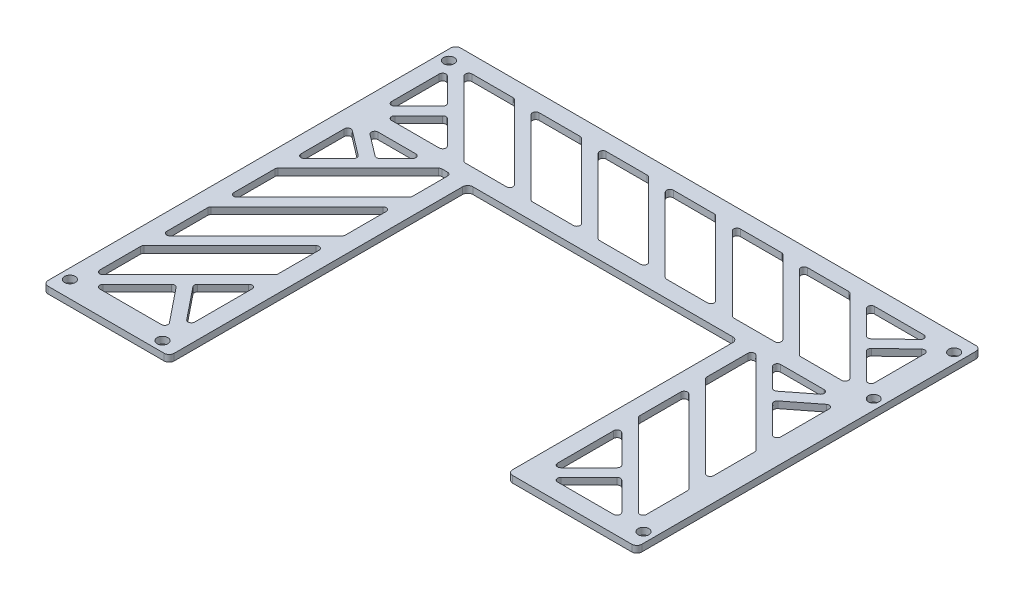
from build123d import *

# Parameters (mm, degrees)
EXTRUDE_1_DEPTH     = 2
SKETCH_2_R          = 1.6
CUT_EXTRUDE_1_DEPTH = 2
SKETCH_3_W          = 27.6
SKETCH_3_H          = 82
SKETCH_3_W_2        = 26.5
SKETCH_3_H_2        = 63.6
CUT_EXTRUDE_2_DEPTH = 10
EXTRUDE_6_DEPTH     = 2
SKETCH_8_R          = 1.6
SKETCH_8_W          = 80.5
SKETCH_8_H          = 89
CUT_EXTRUDE_3_DEPTH = 2
FILLET_2_R          = 1.5
FILLET_3_R          = 1
SKETCH_9_R          = 1.6
CUT_EXTRUDE_4_DEPTH = 2


with BuildPart() as part:
    # 草图1 → 凸台-拉伸1 (new body)
    with BuildSketch(Plane(origin=(0, 0, 0), x_dir=(1, 0, 0), z_dir=(0, 1, 0))):
        Polygon((0, 0), (0, -89), (-37.6, -89), (-37.6, 34), (119, 34), (119, -68.6), (80.5, -68.6), (80.5, 0), align=None)
    extrude(amount=EXTRUDE_1_DEPTH)

    # 草图2 → 切除-拉伸1 (cut)
    with BuildSketch(Plane(origin=(0, 2, 0), x_dir=(1, 0, 0), z_dir=(0, 1, 0))):
        with Locations(Location((-34.6, -84, 0), (0, 0, 270))):
            Circle(SKETCH_2_R)
        with Locations(Location((-5, -86, 0), (0, 0, 270))):
            Circle(SKETCH_2_R)
        with Locations(Location((-34.6, 29, 0), (0, 0, 270))):
            Circle(SKETCH_2_R)
        with Locations(Location((116, 5, 0), (0, 0, 270))):
            Circle(SKETCH_2_R)
        with Locations(Location((116, -63.6, 0), (0, 0, 270))):
            Circle(SKETCH_2_R)
    extrude(amount=-CUT_EXTRUDE_1_DEPTH, mode=Mode.SUBTRACT)

    # 草图3 → 切除-拉伸2 (cut)
    with BuildSketch(Plane(origin=(0, 2, 0), x_dir=(1, 0, 0), z_dir=(0, 1, 0))):
        with Locations((-18.8, -41)):
            Rectangle(SKETCH_3_W, SKETCH_3_H)
        Polygon((-32.6, 29), (112, 29), (112, 5), (85.5, 5), (-5, 5), (-32.6, 5), align=None)
        with Locations((98.75, -31.8)):
            Rectangle(SKETCH_3_W_2, SKETCH_3_H_2)
    extrude(amount=-CUT_EXTRUDE_2_DEPTH, mode=Mode.SUBTRACT)

    # 草图7 → 拉伸-薄壁6 (add)
    with BuildSketch(Plane(origin=(0, 2, 0), x_dir=(1, 0, 0), z_dir=(0, 1, 0))):
        Polygon((-33.362563133, -85.237436867), (1.237436867, -50.637436867), (-1.237436867, -48.162563133), (-35.837436867, -82.762563133), align=None)
        Polygon((-33.362563133, -65.237436867), (1.237436867, -30.637436867), (-1.237436867, -28.162563133), (-35.837436867, -62.762563133), align=None)
        Polygon((-33.362563133, -45.237436867), (1.237436867, -10.637436867), (-1.237436867, -8.162563133), (-35.837436867, -42.762563133), align=None)
        Polygon((-33.362563133, -25.237436867), (-4.362563133, 3.762563133), (-6.837436867, 6.237436867), (-35.837436867, -22.762563133), align=None)
        Polygon((118.237436867, -67.362563133), (81.737436867, -30.862563133), (79.262563133, -33.337436867), (115.762563133, -69.837436867), align=None)
        Polygon((118.237436867, -47.362563133), (81.737436867, -10.862563133), (79.262563133, -13.337436867), (115.762563133, -49.837436867), align=None)
        Polygon((-38.837436867, 32.762563133), (-4.837436867, -1.237436867), (-2.362563133, 1.237436867), (-36.362563133, 35.237436867), align=None)
        Polygon((-18.837436867, 32.762563133), (15.162563133, -1.237436867), (17.637436867, 1.237436867), (-16.362563133, 35.237436867), align=None)
        Polygon((1.162563133, 32.762563133), (35.162563133, -1.237436867), (37.637436867, 1.237436867), (3.637436867, 35.237436867), align=None)
        Polygon((21.162563133, 32.762563133), (55.162563133, -1.237436867), (57.637436867, 1.237436867), (23.637436867, 35.237436867), align=None)
        Polygon((41.162563133, 32.762563133), (75.162563133, -1.237436867), (77.637436867, 1.237436867), (43.637436867, 35.237436867), align=None)
        Polygon((61.162563133, 32.762563133), (95.162563133, -1.237436867), (97.637436867, 1.237436867), (63.637436867, 35.237436867), align=None)
        Polygon((81.162563133, 32.762563133), (115.162563133, -1.237436867), (117.637436867, 1.237436867), (83.637436867, 35.237436867), align=None)
        Polygon((-31.362563133, 3.762563133), (-19.362563133, 15.762563133), (-21.837436867, 18.237436867), (-33.837436867, 6.237436867), align=None)
        Polygon((110.793103448, 30.267241379), (98.193103448, 18.267241379), (100.606896552, 15.732758621), (113.206896552, 27.732758621), align=None)
        Polygon((-3.636092576, -80.903525404), (-15.936092576, -65.603525404), (-18.663907424, -67.796474596), (-6.363907424, -83.096474596), align=None)
        Polygon((-33.658895718, -1.39328384), (-21.158895718, -10.89328384), (-19.041104282, -8.10671616), (-31.541104282, 1.39328384), align=None)
        Polygon((118.237436867, -27.362563133), (81.737436867, 9.137436867), (79.262563133, 6.662563133), (115.762563133, -29.837436867), align=None)
        Polygon((86.737436867, -64.837436867), (99.987436867, -51.587436867), (97.512563133, -49.112563133), (84.262563133, -62.362563133), align=None)
        Polygon((110.922723921, 1.37912155), (97.672723921, -8.97087845), (99.827276079, -11.72912155), (113.077276079, -1.37912155), align=None)
    extrude(amount=-EXTRUDE_6_DEPTH)

    # 草图8 → 切除-拉伸3 (cut)
    with BuildSketch(Plane(origin=(0, 2, 0), x_dir=(1, 0, 0), z_dir=(0, 1, 0))):
        with Locations(Location((116, -63.6, 0), (0, 0, 270))):
            Circle(SKETCH_8_R)
        with Locations(Location((-34.6, 29, 0), (0, 0, 270))):
            Circle(SKETCH_8_R)
        with Locations(Location((-34.6, -84, 0), (0, 0, 270))):
            Circle(SKETCH_8_R)
        Polygon((114.525126266, -68.6), (115.762563133, -69.837436867), (117, -68.6), align=None)
        with Locations((40.25, -44.5)):
            Rectangle(SKETCH_8_W, SKETCH_8_H)
        Polygon((119, 34), (-37.6, 34), (-37.6, -89), (-45.6, -89), (-45.6, 34), (-45.6, 36), (119, 36), align=None)
        Polygon((80.925126266, 5), (85.874873734, 5), (81.737436867, 9.137436867), (79.262563133, 6.662563133), align=None)
        Polygon((85.925126266, 0), (85.5, 0.425126266), (85.5, 0), align=None)
        Polygon((93.925126266, 0), (95.162563133, -1.237436867), (96.4, 0), align=None)
        Polygon((-6.837436867, 6.237436867), (-5.6, 5), (-6.125126266, 5), (-7.1, 5.974873734), align=None)
        Polygon((-5, -1.074873734), (-6.074873734, 0), (-5, 0), align=None)
    extrude(amount=-CUT_EXTRUDE_3_DEPTH, mode=Mode.SUBTRACT)

    # 圆角2
    fillet_2_edges = [part.edges().sort_by_distance(p)[0] for p in [
        (0, 1, 0),
        (119, 1, 68.6),
        (-37.6, 1, 89),
        (0, 1, 89),
        (-37.6, 1, -34),
        (80.5, 1, 0),
        (80.5, 1, 68.6),
        (119, 1, -34),
    ]]
    fillet(fillet_2_edges, radius=FILLET_2_R)

    # 圆角3
    fillet_3_edges = [part.edges().sort_by_distance(p)[0] for p in [
        (98.75, 1, 52.824873734),
        (85.5, 1, 61.125126266),
        (112, 1, 21.125126266),
        (85.5, 1, 14.625126266),
        (-30.125126266, 1, 82),
        (-32.6, 1, 44.474873734),
        (-32.6, 1, 24.474873734),
        (-32.6, 1, 2.198044586),
        (-32.6, 1, 64.474873734),
        (-8.125126266, 1, 0),
        (-5, 1, 16.874873734),
        (-5, 1, 36.874873734),
        (-32.6, 1, -26.525126266),
        (-11.074873734, 1, -5),
        (-30.125126266, 1, -5),
        (8.925126266, 1, -5),
        (112, 1, 41.125126266),
        (112, 1, 61.125126266),
        (85.5, 1, -0.425126266),
        (85.5, 1, 34.625126266),
        (108.925126266, 1, -5),
        (-6.125126266, 1, -5),
        (68.925126266, 1, -5),
        (88.925126266, 1, -5),
        (-5, 1, 0),
        (28.925126266, 1, -5),
        (48.925126266, 1, -5),
        (90.874873734, 1, 0),
        (-5, 1, 56.874873734),
        (-5, 1, 79.206957633),
        (-23.074873734, 1, -17),
        (-32.6, 1, -7.474873734),
        (-14.952341738, 1, 66.827215472),
        (-32.6, 1, 79.525126266),
        (-5, 1, 51.925126266),
        (-7.245387001, 1, 82),
        (-17.441792543, 1, 69.316666277),
        (-32.6, 1, 39.525126266),
        (-5, 1, 11.925126266),
        (-32.6, 1, 59.525126266),
        (-5, 1, 31.925126266),
        (-32.6, 1, 19.525126266),
        (-22.755067227, 1, 9.680193493),
        (-29.707836072, 1, 0),
        (-20.257289289, 1, 7.182415555),
        (-13.074873734, 1, 0),
        (101.386239192, 1, 10.511365458),
        (112, 1, 2.220616449),
        (98.892750382, 1, 8.017876648),
        (112, 1, 26.074873734),
        (109.525126266, 1, 63.6),
        (85.5, 1, 39.574873734),
        (96.275126266, 1, 50.35),
        (112, 1, -6.874873734),
        (101.905423132, 1, -16.969450602),
        (89.874873734, 1, -29),
        (-30.125126266, 1, -29),
        (-20.6, 1, -14.525126266),
        (33.874873734, 1, -5),
        (9.874873734, 1, -29),
        (13.874873734, 1, -5),
        (-10.125126266, 1, -29),
        (73.874873734, 1, -5),
        (49.874873734, 1, -29),
        (53.874873734, 1, -5),
        (29.874873734, 1, -29),
        (93.874873734, 1, -5),
        (69.874873734, 1, -29),
        (115.32597205, 1, -3.548901684),
        (114.548901684, 1, -4.32597205),
        (109.15718184, 1, 0),
        (87.974873734, 1, 63.6),
        (84.925126266, 1, -29),
        (112, 1, 46.074873734),
        (109.4625, 1, -29),
        (85.5, 1, 19.574873734),
        (-15.074873734, 1, -29),
        (44.925126266, 1, -29),
        (64.925126266, 1, -29),
        (4.925126266, 1, -29),
        (24.925126266, 1, -29),
        (99.429813376, 1, -19.445060358),
        (112, 1, -26.583333333),
    ]]
    fillet(fillet_3_edges, radius=FILLET_3_R)

    # 草图9 → 切除-拉伸4 (cut)
    with BuildSketch(Plane(origin=(0, 2, 0), x_dir=(1, 0, 0), z_dir=(0, 1, 0))):
        with Locations(Location((116, 29, 0), (0, 0, 270))):
            Circle(SKETCH_9_R)
    extrude(amount=-CUT_EXTRUDE_4_DEPTH, mode=Mode.SUBTRACT)


solid = part.part
